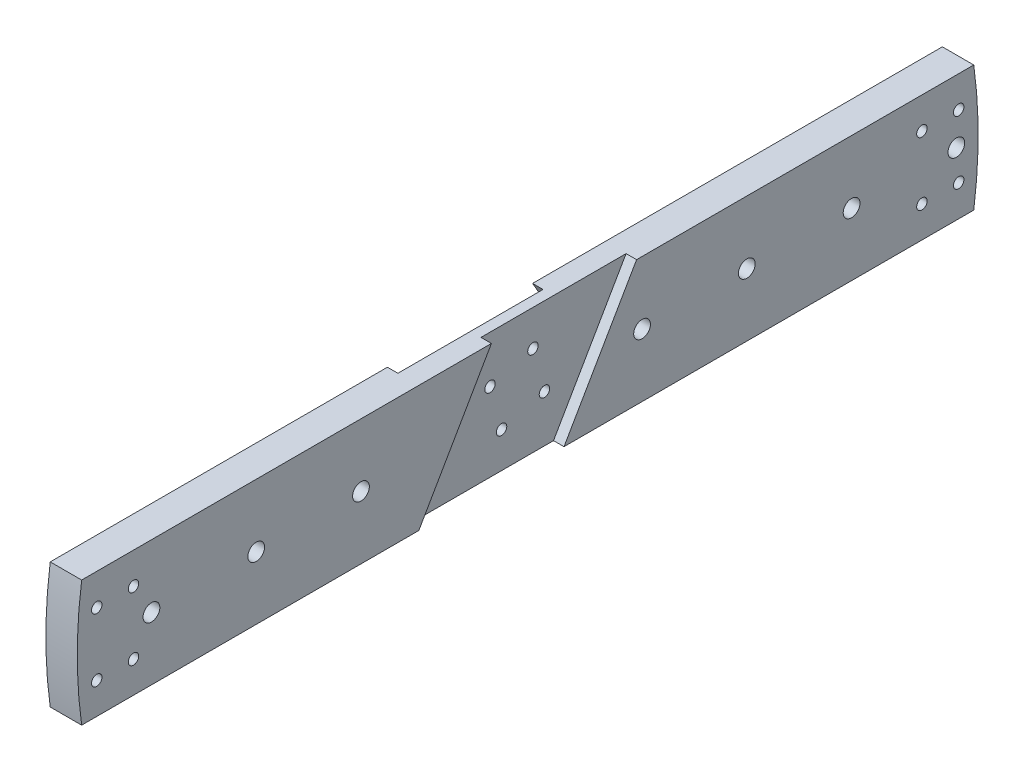
from build123d import *

# Parameters (mm, degrees)
SKETCH2_R           = 3.175
SKETCH2_R_2         = 5.08
BOSS_EXTRUDE1_DEPTH = 19.05
CUT_EXTRUDE2_START  = -12.7
CUT_EXTRUDE2_DEPTH  = 6.35
CUT_EXTRUDE3_DEPTH  = 6.35


with BuildPart() as part:
    # Sketch2 → Boss-Extrude1 (new body)
    with BuildSketch(Plane(origin=(0, 0, 0), x_dir=(0, 0, -1), z_dir=(1, 0, 0))):
        with BuildLine():
            Line((21.997045256, 38.1), (-270.378794472, 38.1))
            ThreePointArc((-270.378794472, 38.1), (-273.05, 0), (-270.378794472, -38.1))
            Line((-270.378794472, -38.1), (270.378794472, -38.1))
            ThreePointArc((270.378794472, -38.1), (273.05, 0), (270.378794472, 38.1))
            Line((270.378794472, 38.1), (21.997045256, 38.1))
        make_face()
        with BuildLine():
            ThreePointArc((11.1125, 19.247414599), (12.274630657, 14.910283942), (7.9375, 13.748153285))
            ThreePointArc((7.9375, 13.748153285), (6.775369343, 18.085283942), (11.1125, 19.247414599))
        make_face(mode=Mode.SUBTRACT)
        with Locations((-16.497783942, 9.525)):
            Circle(SKETCH2_R, mode=Mode.SUBTRACT)
        with Locations((-9.525, -16.497783942)):
            Circle(SKETCH2_R, mode=Mode.SUBTRACT)
        with Locations((16.497783942, -9.525)):
            Circle(SKETCH2_R, mode=Mode.SUBTRACT)
        with Locations((-228.070127818, 0)):
            Circle(SKETCH2_R_2, mode=Mode.SUBTRACT)
        with Locations((-101.070508964, 0)):
            Circle(SKETCH2_R_2, mode=Mode.SUBTRACT)
        with Locations((-164.570319717, 0)):
            Circle(SKETCH2_R_2, mode=Mode.SUBTRACT)
        with Locations((196.320223938, 0)):
            Circle(SKETCH2_R_2, mode=Mode.SUBTRACT)
        with Locations((132.82041491, 0)):
            Circle(SKETCH2_R_2, mode=Mode.SUBTRACT)
        with Locations((69.320600315, 0)):
            Circle(SKETCH2_R_2, mode=Mode.SUBTRACT)
        with Locations((-261.240141142, 19.100852393)):
            Circle(SKETCH2_R, mode=Mode.SUBTRACT)
        with Locations((-238.949490115, 19.110830171)):
            Circle(SKETCH2_R, mode=Mode.SUBTRACT)
        with Locations((-261.240141142, -19.100852393)):
            Circle(SKETCH2_R, mode=Mode.SUBTRACT)
        with Locations((-238.949490115, -19.110830171)):
            Circle(SKETCH2_R, mode=Mode.SUBTRACT)
        with Locations((261.240141142, 19.100852393)):
            Circle(SKETCH2_R, mode=Mode.SUBTRACT)
        with Locations((238.949490115, 19.110830171)):
            Circle(SKETCH2_R, mode=Mode.SUBTRACT)
        with Locations((259.820783483, 0)):
            Circle(SKETCH2_R_2, mode=Mode.SUBTRACT)
        with Locations((238.949490115, -19.110830171)):
            Circle(SKETCH2_R, mode=Mode.SUBTRACT)
        with Locations((261.240141142, -19.100852393)):
            Circle(SKETCH2_R, mode=Mode.SUBTRACT)
    extrude(amount=BOSS_EXTRUDE1_DEPTH)

    # Sketch3 → Cut-Extrude2 (cut)
    with BuildSketch(Plane(origin=(19.05, 0, 0), x_dir=(0, 0, -1), z_dir=(1, 0, 0)).offset(CUT_EXTRUDE2_START)):
        Polygon((65.991135768, -38.1), (21.997045256, 38.1), (-65.991135768, 38.1), (-21.997045256, -38.1), align=None)
    extrude(amount=-CUT_EXTRUDE2_DEPTH, mode=Mode.SUBTRACT)

    # Sketch3<5> → Cut-Extrude3 (cut)
    with BuildSketch(Plane(origin=(19.05, 0, 0), x_dir=(0, 0, -1), z_dir=(1, 0, 0))):
        Polygon((21.997045256, -38.1), (65.991135768, 38.1), (-21.997045256, 38.1), (-65.991135768, -38.1), align=None)
    extrude(amount=-CUT_EXTRUDE3_DEPTH, mode=Mode.SUBTRACT)


solid = part.part
